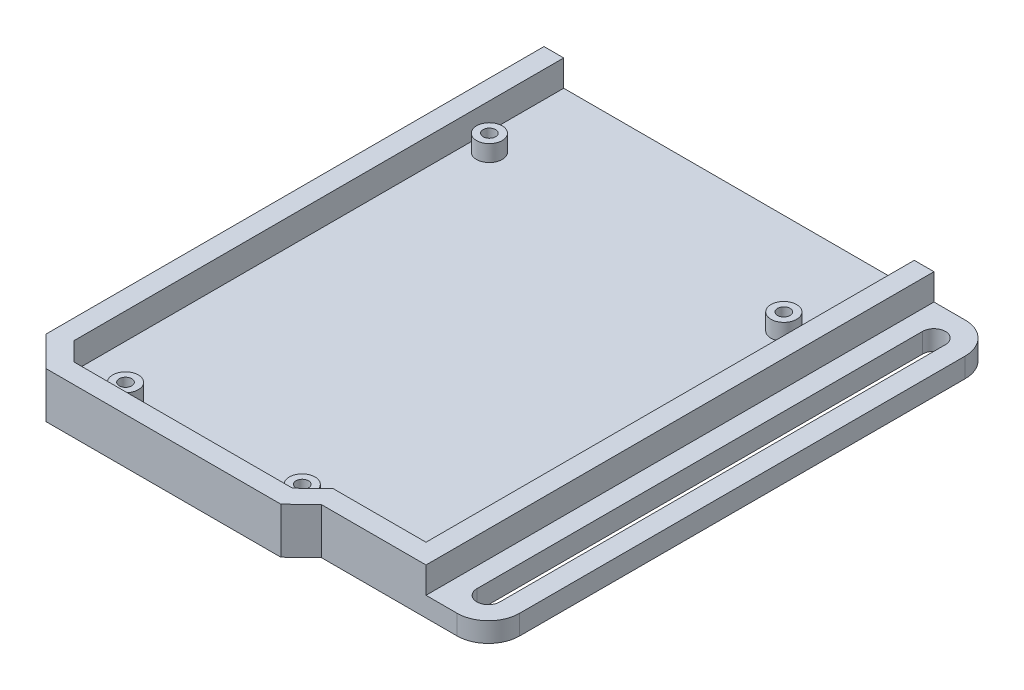
from build123d import *

# Parameters (mm, degrees)
CROQUIS2_R              = 0.95
SALIENTE_EXTRUIR1_DEPTH = 3
SALIENTE_EXTRUIR2_DEPTH = 4
CROQUIS5_R              = 1.95
CROQUIS5_R_2            = 0.95
SALIENTE_EXTRUIR3_DEPTH = 2.5


with BuildPart() as part:
    # Croquis2 → Saliente-Extruir1 (new body)
    # profile 1 of 9: a face of its own
    with BuildSketch(Plane(origin=(0, 0, 0), x_dir=(1, 0, 0), z_dir=(0, 1, 0))):
        Polygon((42.257715083, -74.365742034), (56.391047804, -74.365742034), (56.391047804, 0), (3, 0), (3, -74.607271369), (5.792893219, -77.400164587), (39.10235492, -77.400164587), align=None)
        with Locations((5.766718429, -14.088511522)):
            Circle(CROQUIS2_R, mode=Mode.SUBTRACT)
        with Locations((51.762416691, -15.240864439)):
            Circle(CROQUIS2_R, mode=Mode.SUBTRACT)
        with Locations((10.912444351, -74.653169117)):
            Circle(CROQUIS2_R, mode=Mode.SUBTRACT)
        with Locations((37.82696283, -74.653169117)):
            Circle(CROQUIS2_R, mode=Mode.SUBTRACT)
    # profile 2 of 9: a face of its own
    with BuildSketch(Plane(origin=(0, 0, 0), x_dir=(1, 0, 0), z_dir=(0, 1, 0))):
        Polygon((3, 0), (0, 0), (0, -75.849912056), (4.550252532, -80.400164587), (40.310801486, -80.400164587), (43.466161649, -77.365742034), (59.391047804, -77.365742034), (59.391047804, -72.615742034), (59.391047804, -4.75), (59.391047804, 0), (56.391047804, 0), (56.391047804, -74.365742034), (42.257715083, -74.365742034), (39.10235492, -77.400164587), (5.792893219, -77.400164587), (3, -74.607271369), align=None)
    # profile 3 of 9: a face of its own
    with BuildSketch(Plane(origin=(0, 0, 0), x_dir=(1, 0, 0), z_dir=(0, 1, 0))):
        with Locations((5.766718429, -14.088511522)):
            Circle(CROQUIS2_R)
    # profile 4 of 9: a face of its own
    with BuildSketch(Plane(origin=(0, 0, 0), x_dir=(1, 0, 0), z_dir=(0, 1, 0))):
        with Locations((37.82696283, -74.653169117)):
            Circle(CROQUIS2_R)
    # profile 5 of 9: a face of its own
    with BuildSketch(Plane(origin=(0, 0, 0), x_dir=(1, 0, 0), z_dir=(0, 1, 0))):
        with BuildLine():
            ThreePointArc((64.141047804, 0), (60.782290593, -1.391242789), (59.391047804, -4.75))
            Line((59.391047804, -4.75), (59.391047804, -72.615742034))
            ThreePointArc((59.391047804, -72.615742034), (60.782290593, -75.974499245), (64.141047804, -77.365742034))
            ThreePointArc((64.141047804, -77.365742034), (67.499805014, -75.974499245), (68.891047804, -72.615742034))
            Line((68.891047804, -72.615742034), (68.891047804, -4.75))
            ThreePointArc((68.891047804, -4.75), (67.499805014, -1.391242789), (64.141047804, 0))
        make_face()
        with BuildLine():
            ThreePointArc((62.391047804, -4.75), (64.141047804, -3), (65.891047804, -4.75))
            Line((65.891047804, -4.75), (65.891047804, -72.615742034))
            ThreePointArc((65.891047804, -72.615742034), (64.141047804, -74.365742034), (62.391047804, -72.615742034))
            Line((62.391047804, -72.615742034), (62.391047804, -4.75))
        make_face(mode=Mode.SUBTRACT)
    # profile 6 of 9: a face of its own
    with BuildSketch(Plane(origin=(0, 0, 0), x_dir=(1, 0, 0), z_dir=(0, 1, 0))):
        with Locations((51.762416691, -15.240864439)):
            Circle(CROQUIS2_R)
    # profile 7 of 9: a face of its own
    with BuildSketch(Plane(origin=(0, 0, 0), x_dir=(1, 0, 0), z_dir=(0, 1, 0))):
        with Locations((10.912444351, -74.653169117)):
            Circle(CROQUIS2_R)
    # profile 8 of 9: a face of its own
    with BuildSketch(Plane(origin=(0, 0, 0), x_dir=(1, 0, 0), z_dir=(0, 1, 0))):
        with BuildLine():
            Line((59.391047804, -72.615742034), (59.391047804, -77.365742034))
            Line((59.391047804, -77.365742034), (64.141047804, -77.365742034))
            ThreePointArc((64.141047804, -77.365742034), (60.782290593, -75.974499245), (59.391047804, -72.615742034))
        make_face()
    # profile 9 of 9: a face of its own
    with BuildSketch(Plane(origin=(0, 0, 0), x_dir=(1, 0, 0), z_dir=(0, 1, 0))):
        with BuildLine():
            Line((64.141047804, 0), (59.391047804, 0))
            Line((59.391047804, 0), (59.391047804, -4.75))
            ThreePointArc((59.391047804, -4.75), (60.782290593, -1.391242789), (64.141047804, 0))
        make_face()
    extrude(amount=SALIENTE_EXTRUIR1_DEPTH)

    # Croquis4 → Saliente-Extruir2 (add)
    with BuildSketch(Plane(origin=(0, 3, 0), x_dir=(1, 0, 0), z_dir=(0, 1, 0))):
        Polygon((0, 0), (0, -75.849912056), (4.550252532, -80.400164587), (40.310801486, -80.400164587), (43.466161649, -77.365742034), (59.391047804, -77.365742034), (59.391047804, 0), (56.391047804, 0), (56.391047804, -74.365742034), (42.257715083, -74.365742034), (39.10235492, -77.400164587), (5.792893219, -77.400164587), (3, -74.607271369), (3, 0), align=None)
    extrude(amount=SALIENTE_EXTRUIR2_DEPTH)

    # Croquis5 → Saliente-Extruir3 (add)
    # profile 1 of 4: a face of its own
    with BuildSketch(Plane(origin=(0, 3, 0), x_dir=(1, 0, 0), z_dir=(0, 1, 0))):
        with Locations(Location((5.766718429, -14.088511522, 0), (0, 0, 270))):
            Circle(CROQUIS5_R)
        with Locations(Location((5.766718429, -14.088511522, 0), (0, 0, 270))):
            Circle(CROQUIS5_R_2, mode=Mode.SUBTRACT)
    # profile 2 of 4: a face of its own
    with BuildSketch(Plane(origin=(0, 3, 0), x_dir=(1, 0, 0), z_dir=(0, 1, 0))):
        with Locations(Location((51.762416691, -15.240864439, 0), (0, 0, 270))):
            Circle(CROQUIS5_R)
        with Locations(Location((51.762416691, -15.240864439, 0), (0, 0, 270))):
            Circle(CROQUIS5_R_2, mode=Mode.SUBTRACT)
    # profile 3 of 4: a face of its own
    with BuildSketch(Plane(origin=(0, 3, 0), x_dir=(1, 0, 0), z_dir=(0, 1, 0))):
        with Locations(Location((37.82696283, -74.653169117, 0), (0, 0, 270))):
            Circle(CROQUIS5_R)
        with Locations(Location((37.82696283, -74.653169117, 0), (0, 0, 270))):
            Circle(CROQUIS5_R_2, mode=Mode.SUBTRACT)
    # profile 4 of 4: a face of its own
    with BuildSketch(Plane(origin=(0, 3, 0), x_dir=(1, 0, 0), z_dir=(0, 1, 0))):
        with Locations(Location((10.912444351, -74.653169117, 0), (0, 0, 270))):
            Circle(CROQUIS5_R)
        with Locations(Location((10.912444351, -74.653169117, 0), (0, 0, 270))):
            Circle(CROQUIS5_R_2, mode=Mode.SUBTRACT)
    extrude(amount=SALIENTE_EXTRUIR3_DEPTH)


solid = part.part
